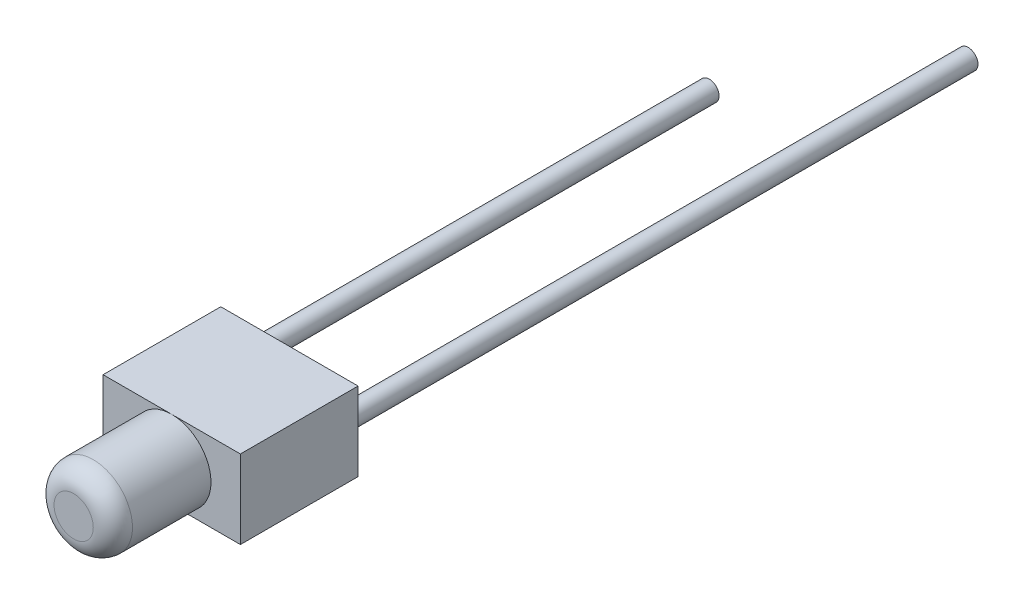
from build123d import *

# Parameters (mm, degrees)
ESBO_O1_W                = 3.4999999999999996
ESBO_O1_H                = 2
RESSALTO_EXTRUS_O1_DEPTH = 5.5
CORTE_EXTRUS_O1_DEPTH    = 2.5
FILETE1_R                = 0.5
ESBO_O3_R                = 0.2500000000000004
ESBO_O3_R_2              = 0.25
RESSALTO_EXTRUS_O2_DEPTH = 16
ESBO_O4_R                = 0.35087883808626286
CORTE_EXTRUS_O2_DEPTH    = 3.9999999999999933


with BuildPart() as part:
    # Esboço1 → Ressalto-extrusão1 (new body)
    with BuildSketch(Plane.XY):
        with Locations((1.7499999999999998, -1)):
            Rectangle(ESBO_O1_W, ESBO_O1_H)
    extrude(amount=RESSALTO_EXTRUS_O1_DEPTH)

    # Esboço2 → Corte-extrusão1 (cut)
    with BuildSketch(Plane.XY.offset(5.5)):
        with BuildLine():
            Line((0, -2), (1.7499999999999791, -1.9999999999999998))
            ThreePointArc((1.7499999999999791, -2), (0.7499999999999996, -1.000000000000021), (1.7499999999999365, 2.2e-16))
            Line((1.7499999999999365, 0), (0, 0))
            Line((0, 0), (0, -2))
        make_face()
        with BuildLine():
            Line((1.7499999999999791, -1.9999999999999998), (3.4999999999999996, -1.9999999999999996))
            Line((3.4999999999999996, -1.9999999999999996), (3.4999999999999996, 0))
            Line((3.4999999999999996, 0), (1.7499999999999365, 0))
            ThreePointArc((1.7499999999999365, 2.2e-16), (2.457106781186525, -0.29289321881343), (2.75, -1))
            ThreePointArc((2.75, -1.0000000000000002), (2.4571067811865404, -1.7071067811865546), (1.7499999999999791, -2))
        make_face()
    extrude(amount=-CORTE_EXTRUS_O1_DEPTH, mode=Mode.SUBTRACT)

    # Filete1
    filete1_edges = [part.edges().sort_by_distance(p)[0] for p in [
        (1.7500000000000198, 2.2e-16, 5.5),
    ]]
    fillet(filete1_edges, radius=FILETE1_R)

    # Esboço3 → Ressalto-extrusão2 (add)
    with BuildSketch(Plane(origin=(0, 0, 0), x_dir=(-1, 0, 0), z_dir=(0, 0, -1))):
        with Locations(Location((-3.05, -1, 0), (0, 0, 180))):
            Circle(ESBO_O3_R)
        with Locations(Location((-0.45, -1, 0), (0, 0, 180))):
            Circle(ESBO_O3_R_2)
    extrude(amount=RESSALTO_EXTRUS_O2_DEPTH)

    # Esboço4 → Corte-extrusão2 (cut)
    with BuildSketch(Plane(origin=(0, 0, -16), x_dir=(-1, 0, 0), z_dir=(0, 0, -1))):
        with Locations((-0.45, -1)):
            Circle(ESBO_O4_R)
    extrude(amount=-CORTE_EXTRUS_O2_DEPTH, mode=Mode.SUBTRACT)


solid = part.part
